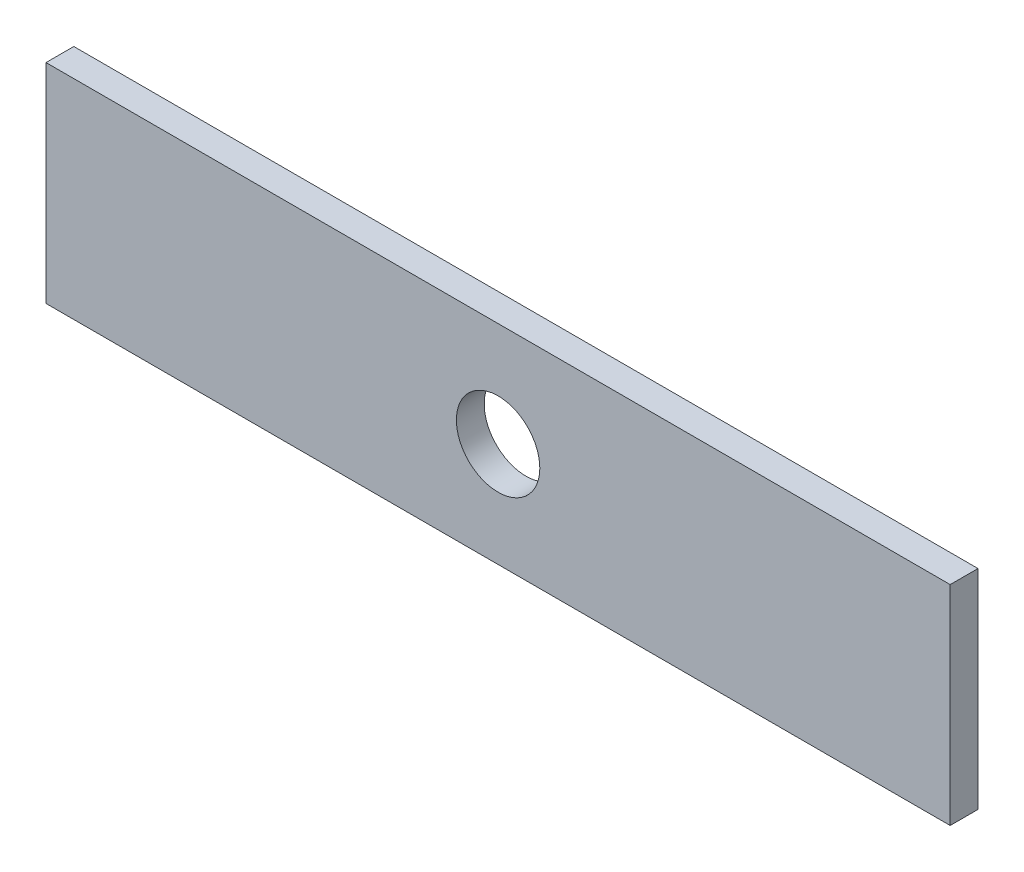
from build123d import *

# Parameters (mm, degrees)
ESBO_O1_W                = 65
ESBO_O1_H                = 15
ESBO_O1_R                = 3
RESSALTO_EXTRUS_O1_DEPTH = 2


with BuildPart() as part:
    # Esboço1 → Ressalto-extrusão1 (new body)
    with BuildSketch(Plane.XY):
        with Locations((2.444259717, 8.526170799)):
            Rectangle(ESBO_O1_W, ESBO_O1_H)
        with Locations((2.444259717, 8.526170799)):
            Circle(ESBO_O1_R, mode=Mode.SUBTRACT)
    extrude(amount=RESSALTO_EXTRUS_O1_DEPTH)


solid = part.part
